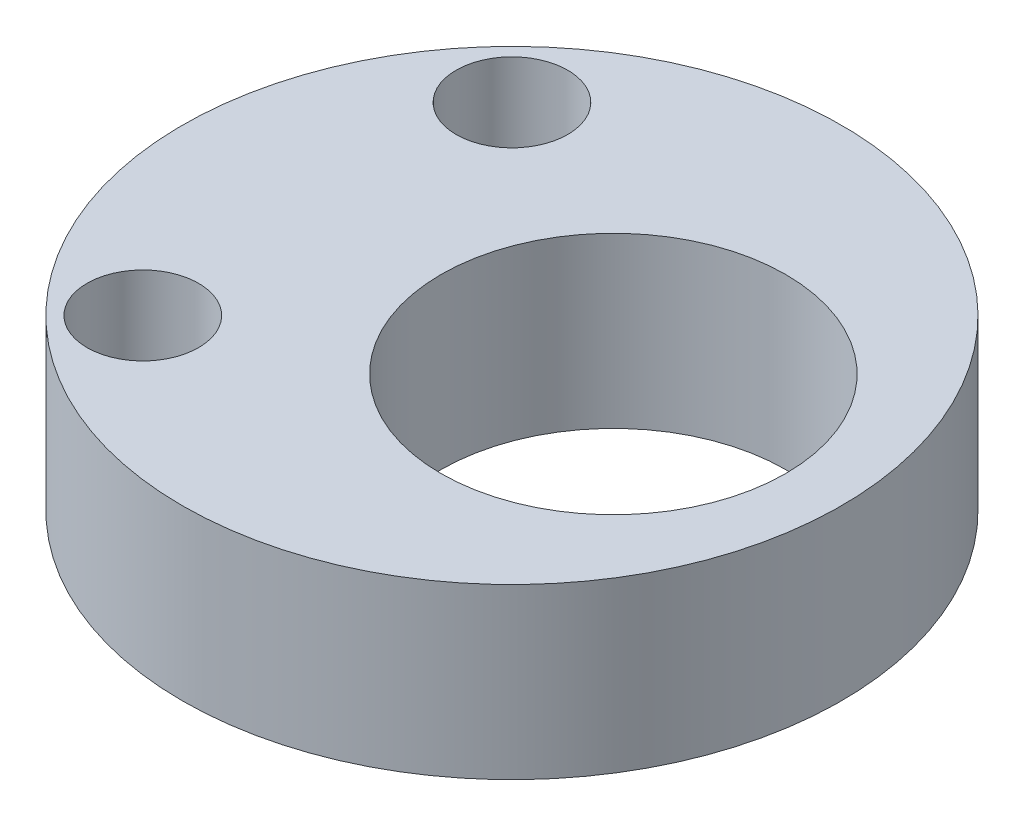
from build123d import *

# Parameters (mm, degrees)
SKETCH1_R           = 9.75
SKETCH1_R_2         = 5.1
SKETCH1_R_3         = 1.65
BOSS_EXTRUDE4_DEPTH = 5


with BuildPart() as part:
    # Sketch1 → Boss-Extrude4 (new body)
    with BuildSketch(Plane(origin=(0, 0, 0), x_dir=(1, 0, 0), z_dir=(0, 1, 0))):
        with Locations(Location((0, 0, 0), (0, 0, 270))):
            Circle(SKETCH1_R)
        with Locations(Location((3, 0, 0), (0, 0, 270))):
            Circle(SKETCH1_R_2, mode=Mode.SUBTRACT)
        with Locations(Location((-5.46, 5.46, 0), (0, 0, 270))):
            Circle(SKETCH1_R_3, mode=Mode.SUBTRACT)
        with Locations(Location((-5.46, -5.46, 0), (0, 0, 270))):
            Circle(SKETCH1_R_3, mode=Mode.SUBTRACT)
    extrude(amount=BOSS_EXTRUDE4_DEPTH)


solid = part.part
